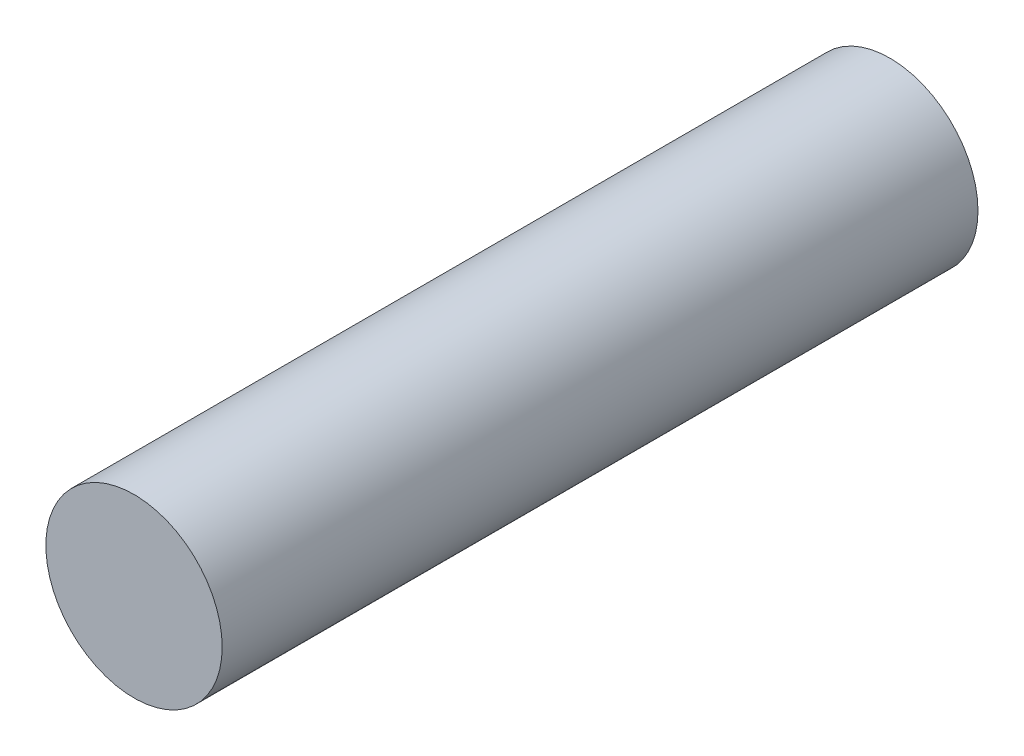
from build123d import *

# Parameters (mm, degrees)
SKETCH1_R           = 1.75
BOSS_EXTRUDE1_DEPTH = 15


with BuildPart() as part:
    # Sketch1 → Boss-Extrude1 (new body)
    with BuildSketch(Plane.XY):
        Circle(SKETCH1_R)
    extrude(amount=BOSS_EXTRUDE1_DEPTH)


solid = part.part
